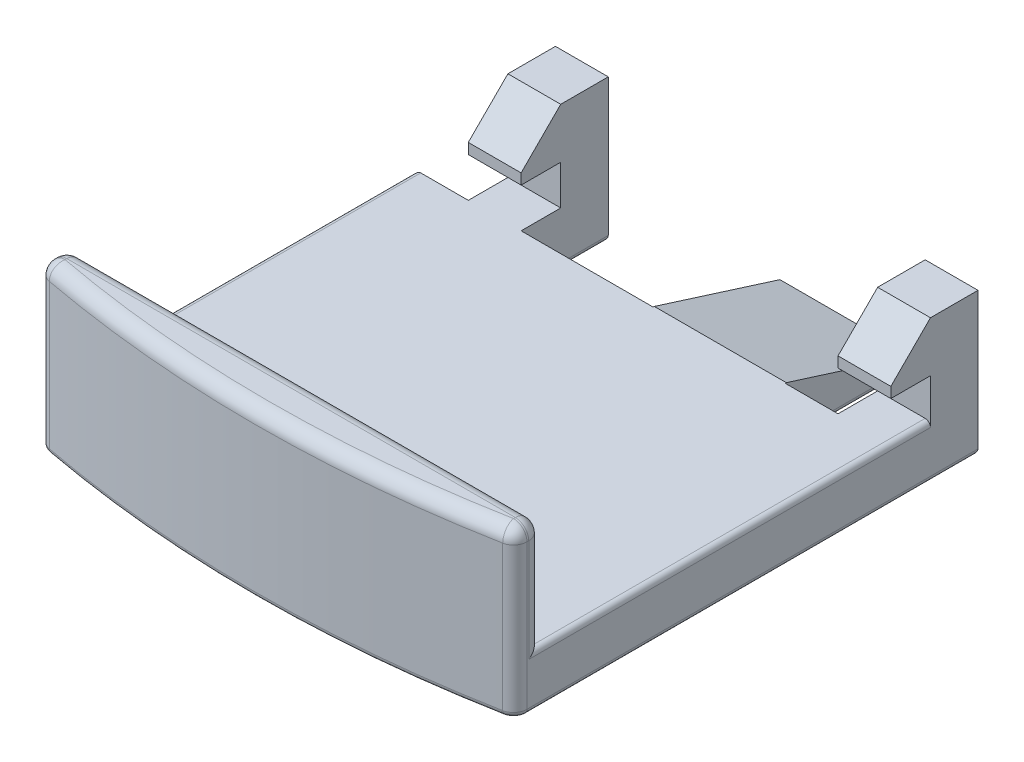
from build123d import *

# Parameters (mm, degrees)
SKETCH1_W                = 9
SKETCH1_H                = 1
BOSS_EXTRUDE1_DEPTH      = 4.5
BOSS_EXTRUDE2_DEPTH      = 2.1
BOSS_EXTRUDE2_DEPTH_BACK = 1
FILLET1_R                = 0.255
SKETCH3_W                = 1
SKETCH3_H                = 3.438773138
SKETCH3_W_2              = 2.5
SKETCH3_H_2              = 3.613088827
SKETCH3_W_3              = 2.495866097
SKETCH3_H_3              = 3.882485801
CUT_EXTRUDE1_DEPTH       = 9
CHAMFER1_SIZE            = 0.75
CHAMFER1_SIZE2           = 2.378696102
SKETCH4_W                = 1
SKETCH4_H                = 2.4
BOSS_EXTRUDE3_DEPTH      = 1.7
SKETCH5_W                = 0.75
SKETCH5_H                = 0.75
CUT_EXTRUDE2_DEPTH       = 10.85
CHAMFER2_SIZE            = 0.75
SKETCH6_W                = 3.885576696
SKETCH6_H                = 1.699016426
SKETCH6_W_2              = 2.747974394
SKETCH6_H_2              = 0.842121185
CUT_EXTRUDE3_DEPTH       = 21.7
FILLET2_R                = 0.1


with BuildPart() as part:
    # Sketch1 → Boss-Extrude1 (new, symmetric)
    with BuildSketch(Plane.XY):
        Rectangle(SKETCH1_W, SKETCH1_H)
    extrude(amount=BOSS_EXTRUDE1_DEPTH, both=True)

    # Sketch2 → Boss-Extrude2 (add, two sides: drawn at the far end of the back side and taken through both)
    with BuildSketch(Plane(origin=(0, 0.5, 0), x_dir=(1, 0, 0), z_dir=(0, 1, 0)).offset(-BOSS_EXTRUDE2_DEPTH_BACK)):
        with BuildLine():
            Line((-4.5, -4.5), (-4.5, -5))
            ThreePointArc((-4.5, -5), (0, -5.438805544), (4.5, -5))
            Line((4.5, -5), (4.5, -4.5))
            Line((4.5, -4.5), (-4.5, -4.5))
        make_face()
    extrude(amount=BOSS_EXTRUDE2_DEPTH + BOSS_EXTRUDE2_DEPTH_BACK)

    # Fillet1
    fillet1_edges = [part.edges().sort_by_distance(p)[0] for p in [
        (0, 2.6, 4.5),
        (4.5, 2.6, 4.75),
        (0, 2.6, 5.438805544),
        (-4.5, 2.6, 4.75),
        (4.5, 1.55, 4.5),
        (-4.5, 1.55, 4.5),
        (4.5, 1.05, 5),
        (-4.5, 1.05, 5),
    ]]
    fillet(fillet1_edges, radius=FILLET1_R)

    # Sketch3 → Cut-Extrude1 (cut)
    with BuildSketch(Plane(origin=(0, 0.5, 0), x_dir=(1, 0, 0), z_dir=(0, 1, 0))):
        with Locations((3, 3.819386569)):
            Rectangle(SKETCH3_W, SKETCH3_H)
        with Locations((-1.25, 3.906544413)):
            Rectangle(SKETCH3_W_2, SKETCH3_H_2)
        with Locations((-4.747933049, 4.041242901)):
            Rectangle(SKETCH3_W_3, SKETCH3_H_3)
    extrude(amount=-CUT_EXTRUDE1_DEPTH, mode=Mode.SUBTRACT)

    # Chamfer1
    chamfer1_edges = [part.edges().sort_by_distance(p)[0] for p in [
        (1.25, 0.5, -4.5),
    ]]
    chamfer1_side = [part.faces().sort_by_distance(p)[0] for p in [
        (1.25, 0, -4.5),
    ]]
    chamfer(chamfer1_edges, length=CHAMFER1_SIZE, length2=CHAMFER1_SIZE2, reference=chamfer1_side[0])

    # Sketch4 → Boss-Extrude3 (add)
    with BuildSketch(Plane(origin=(0, 0.5, 0), x_dir=(1, 0, 0), z_dir=(0, 1, 0))):
        with Locations((4, 3.3)):
            Rectangle(SKETCH4_W, SKETCH4_H)
        with Locations((-3, 3.3)):
            Rectangle(SKETCH4_W, SKETCH4_H)
    extrude(amount=BOSS_EXTRUDE3_DEPTH)

    # Sketch5 → Cut-Extrude2 (cut, symmetric)
    with BuildSketch(Plane.ZY.offset(-3.5)):
        with Locations((-2.475, 0.875)):
            Rectangle(SKETCH5_W, SKETCH5_H)
    extrude(amount=CUT_EXTRUDE2_DEPTH, both=True, mode=Mode.SUBTRACT)

    # Chamfer2
    chamfer2_edges = [part.edges().sort_by_distance(p)[0] for p in [
        (4, 2.2, -2.1),
        (-3, 2.2, -2.1),
    ]]
    chamfer(chamfer2_edges, length=CHAMFER2_SIZE)

    # Sketch6 → Cut-Extrude3 (cut)
    with BuildSketch(Plane(origin=(0, 2.2, 0), x_dir=(1, 0, 0), z_dir=(0, 1, 0))):
        with Locations((-3.730449109, 4.599508213)):
            Rectangle(SKETCH6_W, SKETCH6_H)
        with Locations((4.565183266, 4.171060592)):
            Rectangle(SKETCH6_W_2, SKETCH6_H_2)
    extrude(amount=-CUT_EXTRUDE3_DEPTH, mode=Mode.SUBTRACT)

    # Fillet2
    fillet2_edges = [part.edges().sort_by_distance(p)[0] for p in [
        (-3.5, -0.5, -2.925),
        (-4.5, 0, -2.1),
        (-4, -0.5, -2.1),
        (-2.5, -0.5, -2.925),
        (-3, -0.5, -3.75),
        (4, -0.5, -3.75),
        (4.5, -0.5, 0.519670946),
        (0, -0.5, 5.438805544),
        (-4.5, -0.5, 1.344670946),
        (-4.441222256, -0.5, 4.952197123),
        (4.441222256, -0.5, 4.952197123),
        (-4.5, 0.5, 1.3275),
        (3, -0.5, -2.1),
        (4.5, 0.5, 0.9525),
        (2.5, -0.5, -3.3),
        (3.5, -0.5, -2.925),
        (1.25, -0.5, -4.5),
        (0, -0.5, -3.3),
        (-1.25, -0.5, -2.1),
    ]]
    fillet(fillet2_edges, radius=FILLET2_R)


solid = part.part
